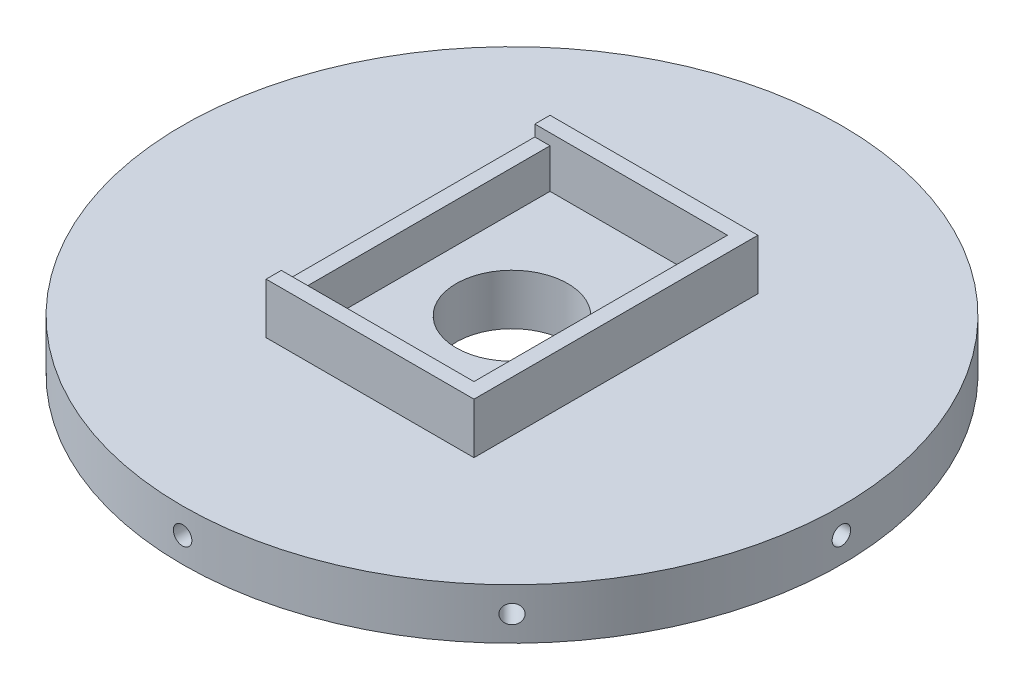
from build123d import *

# Parameters (mm, degrees)
SKETCH2_W           = 41
SKETCH2_H           = 56
SKETCH2_W_2         = 35
SKETCH2_H_2         = 50
BOSS_EXTRUDE1_DEPTH = 20
BOSS_EXTRUDE2_DEPTH = 10
SKETCH2_4_W         = 35
SKETCH2_4_H         = 50
SKETCH2_4_R         = 11
BOSS_EXTRUDE3_DEPTH = 10
SKETCH10_W          = 50
SKETCH10_H          = 2.212003264
CUT_EXTRUDE1_DEPTH  = 10
CUT_EXTRUDE2_START  = 65
SKETCH12_R          = 1.825
CUT_EXTRUDE2_DEPTH  = 11
CIRPATTERN1_COUNT   = 8


with BuildPart() as part:
    # Sketch2 → Boss-Extrude1 (new body)
    with BuildSketch(Plane(origin=(0, 0, 0), x_dir=(1, 0, 0), z_dir=(0, 1, 0))):
        Rectangle(SKETCH2_W, SKETCH2_H)
        Rectangle(SKETCH2_W_2, SKETCH2_H_2, mode=Mode.SUBTRACT)
    extrude(amount=BOSS_EXTRUDE1_DEPTH)

    # Sketch2<3> → Boss-Extrude2 (add)
    with BuildSketch(Plane(origin=(0, 0, 0), x_dir=(1, 0, 0), z_dir=(0, 1, 0))):
        with BuildLine():
            ThreePointArc((65, 0), (45.961940777, 45.961940777), (0, 65))
            ThreePointArc((0, 65), (-45.961940777, -45.961940777), (65, 0))
        make_face()
        Polygon((-20.5, -28), (-20.5, 0), (-20.5, 28), (0, 28), (20.5, 28), (20.5, 0), (20.5, -28), align=None, mode=Mode.SUBTRACT)
    extrude(amount=BOSS_EXTRUDE2_DEPTH)

    # Sketch2<4> → Boss-Extrude3 (add)
    with BuildSketch(Plane(origin=(0, 0, 0), x_dir=(1, 0, 0), z_dir=(0, 1, 0))):
        Rectangle(SKETCH2_4_W, SKETCH2_4_H)
        Circle(SKETCH2_4_R, mode=Mode.SUBTRACT)
    extrude(amount=BOSS_EXTRUDE3_DEPTH)

    # Sketch10 → Cut-Extrude1 (cut)
    with BuildSketch(Plane.ZY.offset(20.5)):
        with Locations((0, 18.893998368)):
            Rectangle(SKETCH10_W, SKETCH10_H)
    extrude(amount=-CUT_EXTRUDE1_DEPTH, mode=Mode.SUBTRACT)

    # Sketch12 → Cut-Extrude2 (cut)
    with BuildSketch(Plane.XY.offset(CUT_EXTRUDE2_START)):
        with Locations((0, 5)):
            Circle(SKETCH12_R)
    cut_extrude2 = extrude(amount=-CUT_EXTRUDE2_DEPTH, mode=Mode.SUBTRACT)

    # CirPattern1: Cut-Extrude2 ×8 about axis
    cirpattern1_axis = Axis((0, 0, 0), (0, 1, 0))
    for i in range(1, CIRPATTERN1_COUNT):
        add(cut_extrude2.rotate(cirpattern1_axis, i * 360 / CIRPATTERN1_COUNT), mode=Mode.SUBTRACT)


solid = part.part
